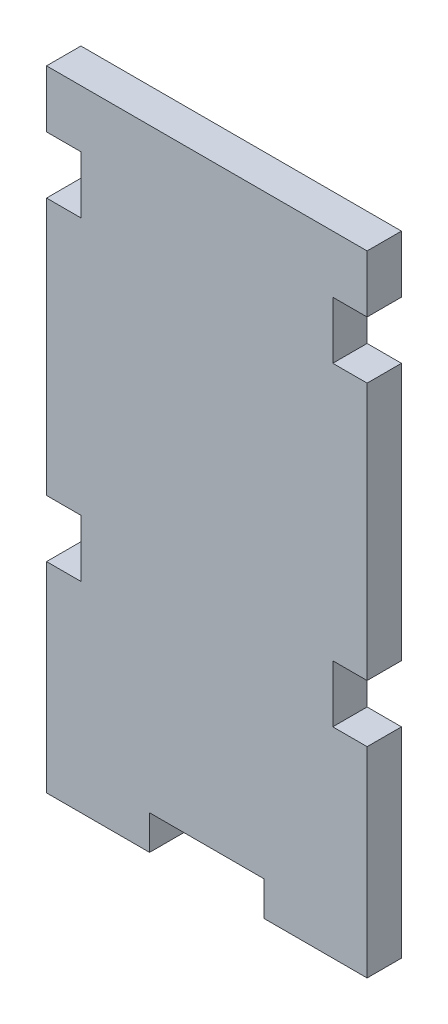
from build123d import *

# Parameters (mm, degrees)
ESQUISSE1_W             = 44
ESQUISSE1_H             = 110
BOSS_EXTRU_1_DEPTH      = 6
ESQUISSE4_W             = 6
ESQUISSE4_H             = 10
ESQUISSE4_H_2           = 45
ESQUISSE4_H_3           = 35
BOSS_EXTRU_2_DEPTH      = 6
ESQUISSE5_W             = 20
ESQUISSE5_H             = 6
ENL_V_MAT_EXTRU_1_DEPTH = 6


with BuildPart() as part:
    # Esquisse1 → Boss.-Extru.1 (new body)
    with BuildSketch(Plane.XY):
        with Locations((22, 55)):
            Rectangle(ESQUISSE1_W, ESQUISSE1_H)
    extrude(amount=BOSS_EXTRU_1_DEPTH)

    # Esquisse4 → Boss.-Extru.2 (add)
    with BuildSketch(Plane.XY.offset(6)):
        with Locations((-3, 105)):
            Rectangle(ESQUISSE4_W, ESQUISSE4_H)
        with Locations((-3, 67.5)):
            Rectangle(ESQUISSE4_W, ESQUISSE4_H_2)
        with Locations((-3, 17.5)):
            Rectangle(ESQUISSE4_W, ESQUISSE4_H_3)
        with Locations((47, 17.5)):
            Rectangle(ESQUISSE4_W, ESQUISSE4_H_3)
        with Locations((47, 67.5)):
            Rectangle(ESQUISSE4_W, ESQUISSE4_H_2)
        with Locations((47, 105)):
            Rectangle(ESQUISSE4_W, ESQUISSE4_H)
    extrude(amount=-BOSS_EXTRU_2_DEPTH)

    # Esquisse5 → Enlèv. mat.-Extru.1 (cut)
    with BuildSketch(Plane(origin=(0, 0, 0), x_dir=(-1, 0, 0), z_dir=(0, 0, -1))):
        with Locations((-22, 3)):
            Rectangle(ESQUISSE5_W, ESQUISSE5_H)
    extrude(amount=-ENL_V_MAT_EXTRU_1_DEPTH, mode=Mode.SUBTRACT)


solid = part.part
